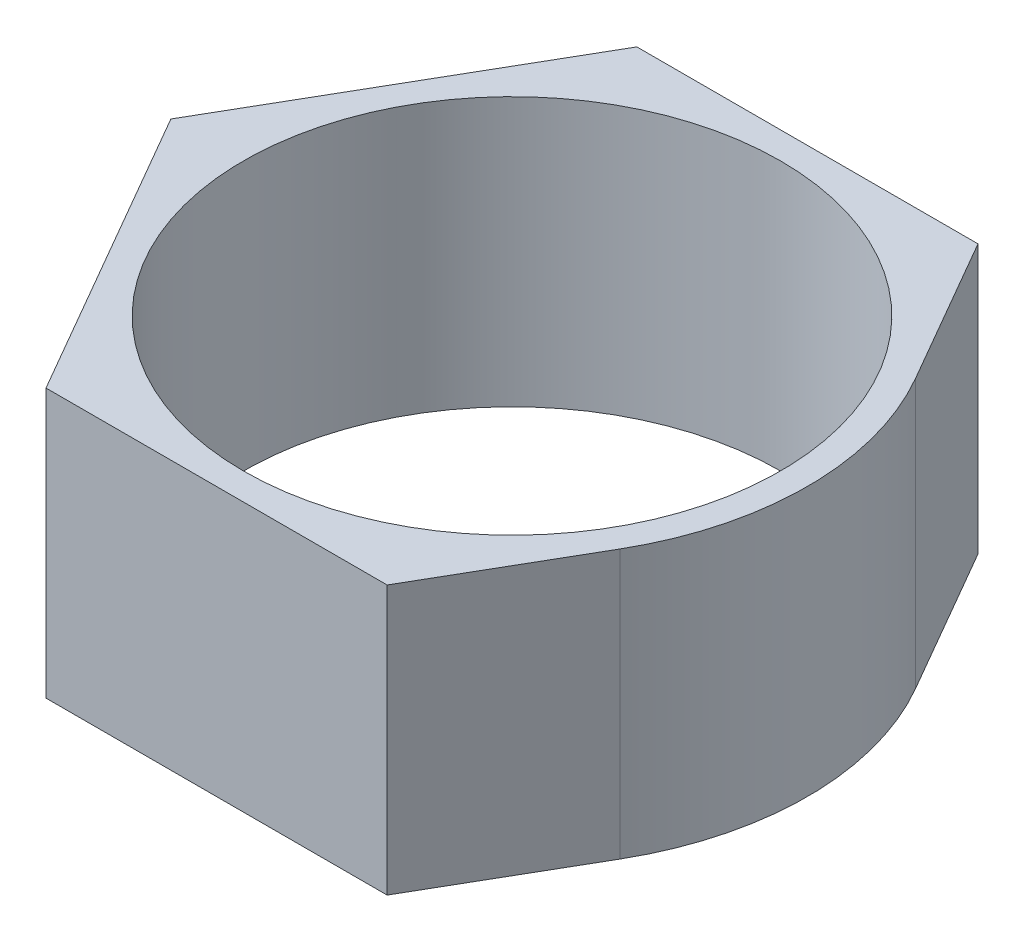
from build123d import *

# Parameters (mm, degrees)
SKETCH1_R           = 11
SKETCH1_R_2         = 10
BOSS_EXTRUDE3_DEPTH = 10


with BuildPart() as part:
    # Sketch1 → Boss-Extrude3 (new body)
    # profile 1 of 6: a face of its own
    with BuildSketch(Plane(origin=(0, 0, 0), x_dir=(1, 0, 0), z_dir=(0, 1, 0))):
        Circle(SKETCH1_R)
        with Locations(Location((0, 0, 0), (0, 0, 270))):
            Circle(SKETCH1_R_2, mode=Mode.SUBTRACT)
    # profile 2 of 6: a face of its own
    with BuildSketch(Plane(origin=(0, 0, 0), x_dir=(1, 0, 0), z_dir=(0, 1, 0))):
        with BuildLine():
            ThreePointArc((-9.526279142, -5.500000519), (-11, -3e-09), (-9.526279145, 5.500000513))
            Line((-9.526279145, 5.500000513), (-12.701705922, 0))
            Line((-12.701705922, 0), (-9.526279142, -5.500000519))
        make_face()
    # profile 3 of 6: a face of its own
    with BuildSketch(Plane(origin=(0, 0, 0), x_dir=(1, 0, 0), z_dir=(0, 1, 0))):
        with BuildLine():
            Line((-6.350852961, -11), (5.6e-08, -11))
            ThreePointArc((5.6e-08, -11), (-5.499999716, -9.526279605), (-9.526279142, -5.500000519))
            Line((-9.526279142, -5.500000519), (-6.350852961, -11))
        make_face()
    # profile 4 of 6: a face of its own
    with BuildSketch(Plane(origin=(0, 0, 0), x_dir=(1, 0, 0), z_dir=(0, 1, 0))):
        with BuildLine():
            Line((6.350852961, -11), (9.526279442, -5.5))
            ThreePointArc((9.526279442, -5.5), (5.500000024, -9.526279428), (5.6e-08, -11))
            Line((5.6e-08, -11), (6.350852961, -11))
        make_face()
    # profile 5 of 6: a face of its own
    with BuildSketch(Plane(origin=(0, 0, 0), x_dir=(1, 0, 0), z_dir=(0, 1, 0))):
        with BuildLine():
            ThreePointArc((0, 11), (5.5, 9.526279442), (9.526279442, 5.5))
            Line((9.526279442, 5.5), (6.350852961, 11))
            Line((6.350852961, 11), (0, 11))
        make_face()
    # profile 6 of 6: a face of its own
    with BuildSketch(Plane(origin=(0, 0, 0), x_dir=(1, 0, 0), z_dir=(0, 1, 0))):
        with BuildLine():
            ThreePointArc((-9.526279145, 5.500000513), (-5.499999743, 9.52627959), (0, 11))
            Line((0, 11), (-6.350852961, 11))
            Line((-6.350852961, 11), (-9.526279145, 5.500000513))
        make_face()
    extrude(amount=BOSS_EXTRUDE3_DEPTH)


solid = part.part
